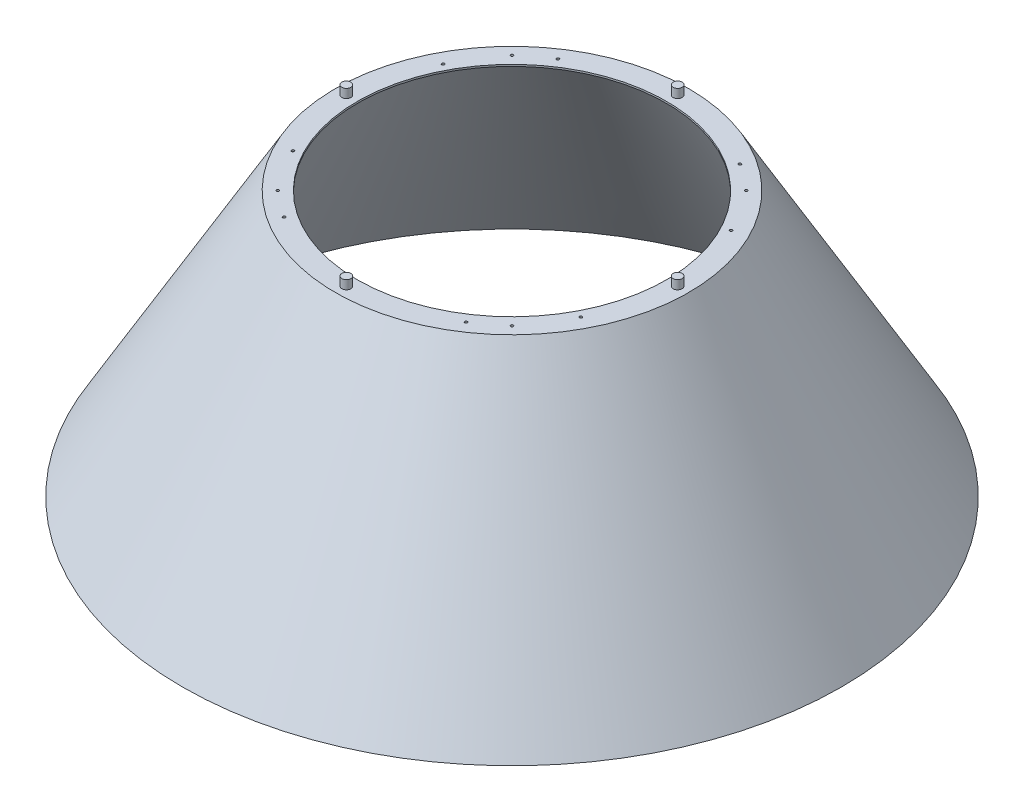
from build123d import *

# Parameters (mm, degrees)
SKETCH2_R           = 200
BOSS_EXTRUDE1_DEPTH = 300
BOSS_EXTRUDE1_DRAFT = -30
SHELL1_T            = -2
CUT_EXTRUDE1_REACH  = 1631.392
SKETCH3_R           = 1.5
SKETCH3_R_2         = 175
SKETCH4_R           = 5.1
BOSS_EXTRUDE2_DEPTH = 10
CUT_EXTRUDE4_REACH  = 1631.392
SKETCH5_R           = 1.5


with BuildPart() as part:
    # Sketch2 → Boss-Extrude1 (with draft: the straight prism first)
    with BuildSketch(Plane.XZ.offset(-263.664131829)):
        with Locations((394.086664394, 1032.562454189)):
            Circle(SKETCH2_R)
    extrude(amount=BOSS_EXTRUDE1_DEPTH)
    # Boss-Extrude1: the draft: its side faces are tilted about the plane it starts from
    boss_extrude1_sides = [part.faces().sort_by_distance(p)[0] for p in [
        (194.086664394, 113.664131829, 1032.562454189),
    ]]
    draft(boss_extrude1_sides, Plane.XZ.offset(-263.664131829), BOSS_EXTRUDE1_DRAFT)

    # Shell1
    shell1_openings = [part.faces().sort_by_distance(p)[0] for p in [
        (394.086664394, -36.335868171, 1032.562454189),
    ]]
    offset(amount=SHELL1_T, openings=shell1_openings, kind=Kind.INTERSECTION)

    # Sketch3 → Cut-Extrude1 (cut, up to next)
    with BuildSketch(Plane(origin=(0, 263.664131829, 0), x_dir=(1, 0, 0), z_dir=(0, 1, 0)), mode=Mode.PRIVATE) as cut_extrude1_sk1:
        with Locations(Location((261.504142922, -1165.144975661, 0), (0, 0, 270))):
            Circle(SKETCH3_R)
    cut_extrude1_tool1 = extrude(cut_extrude1_sk1.sketch, amount=-CUT_EXTRUDE1_REACH, mode=Mode.PRIVATE) & part.part
    # Sketch3 → Cut-Extrude1 (cut, up to next)
    with BuildSketch(Plane(origin=(0, 263.664131829, 0), x_dir=(1, 0, 0), z_dir=(0, 1, 0)), mode=Mode.PRIVATE) as cut_extrude1_sk2:
        with Locations(Location((526.669185867, -1165.144975661, 0), (0, 0, 270))):
            Circle(SKETCH3_R)
    cut_extrude1_tool2 = extrude(cut_extrude1_sk2.sketch, amount=-CUT_EXTRUDE1_REACH, mode=Mode.PRIVATE) & part.part
    # Sketch3 → Cut-Extrude1 (cut, up to next)
    with BuildSketch(Plane(origin=(0, 263.664131829, 0), x_dir=(1, 0, 0), z_dir=(0, 1, 0)), mode=Mode.PRIVATE) as cut_extrude1_sk3:
        with Locations(Location((526.669185867, -899.979932716, 0), (0, 0, 270))):
            Circle(SKETCH3_R)
    cut_extrude1_tool3 = extrude(cut_extrude1_sk3.sketch, amount=-CUT_EXTRUDE1_REACH, mode=Mode.PRIVATE) & part.part
    # Sketch3 → Cut-Extrude1 (cut, up to next)
    with BuildSketch(Plane(origin=(0, 263.664131829, 0), x_dir=(1, 0, 0), z_dir=(0, 1, 0)), mode=Mode.PRIVATE) as cut_extrude1_sk4:
        with Locations(Location((261.504142922, -899.979932716, 0), (0, 0, 270))):
            Circle(SKETCH3_R)
    cut_extrude1_tool4 = extrude(cut_extrude1_sk4.sketch, amount=-CUT_EXTRUDE1_REACH, mode=Mode.PRIVATE) & part.part
    # Sketch3 → Cut-Extrude1 (cut, up to next)
    with BuildSketch(Plane(origin=(0, 263.664131829, 0), x_dir=(1, 0, 0), z_dir=(0, 1, 0)), mode=Mode.PRIVATE) as cut_extrude1_sk5:
        with Locations(Location((394.086664394, -1032.562454189, 0), (0, 0, 270))):
            Circle(SKETCH3_R_2)
    cut_extrude1_tool5 = extrude(cut_extrude1_sk5.sketch, amount=-CUT_EXTRUDE1_REACH, mode=Mode.PRIVATE) & part.part
    add(cut_extrude1_tool1.solids().sort_by_distance((261.504143, 263.664132, 1165.144976))[0], mode=Mode.SUBTRACT)
    add(cut_extrude1_tool2.solids().sort_by_distance((526.669186, 263.664132, 1165.144976))[0], mode=Mode.SUBTRACT)
    add(cut_extrude1_tool3.solids().sort_by_distance((526.669186, 263.664132, 899.979933))[0], mode=Mode.SUBTRACT)
    add(cut_extrude1_tool4.solids().sort_by_distance((261.504143, 263.664132, 899.979933))[0], mode=Mode.SUBTRACT)
    add(cut_extrude1_tool5.solids().sort_by_distance((394.086664, 263.664132, 1032.562454))[0], mode=Mode.SUBTRACT)

    # Sketch4 → Boss-Extrude2 (add)
    with BuildSketch(Plane(origin=(0, 263.664131829, 0), x_dir=(1, 0, 0), z_dir=(0, 1, 0))):
        with Locations(Location((206.586664394, -1032.562454189, 0), (0, 0, 90))):
            Circle(SKETCH4_R)
        with Locations(Location((394.086664394, -845.062454189, 0), (0, 0, 90))):
            Circle(SKETCH4_R)
        with Locations(Location((581.586664394, -1032.562454189, 0), (0, 0, 90))):
            Circle(SKETCH4_R)
        with Locations(Location((394.086664394, -1220.062454189, 0), (0, 0, 90))):
            Circle(SKETCH4_R)
    extrude(amount=BOSS_EXTRUDE2_DEPTH)

    # Sketch5 → Cut-Extrude4 (cut, up to next)
    with BuildSketch(Plane(origin=(0, 263.664131829, 0), x_dir=(1, 0, 0), z_dir=(0, 1, 0)), mode=Mode.PRIVATE) as cut_extrude4_sk1:
        with Locations(Location((231.086664394, -1117.562454189, 0), (0, 0, 270))):
            Circle(SKETCH5_R)
    cut_extrude4_tool1 = extrude(cut_extrude4_sk1.sketch, amount=-CUT_EXTRUDE4_REACH, mode=Mode.PRIVATE) & part.part
    # Sketch5 → Cut-Extrude4 (cut, up to next)
    with BuildSketch(Plane(origin=(0, 263.664131829, 0), x_dir=(1, 0, 0), z_dir=(0, 1, 0)), mode=Mode.PRIVATE) as cut_extrude4_sk2:
        with Locations(Location((557.086664394, -1117.562454189, 0), (0, 0, 270))):
            Circle(SKETCH5_R)
    cut_extrude4_tool2 = extrude(cut_extrude4_sk2.sketch, amount=-CUT_EXTRUDE4_REACH, mode=Mode.PRIVATE) & part.part
    # Sketch5 → Cut-Extrude4 (cut, up to next)
    with BuildSketch(Plane(origin=(0, 263.664131829, 0), x_dir=(1, 0, 0), z_dir=(0, 1, 0)), mode=Mode.PRIVATE) as cut_extrude4_sk3:
        with Locations(Location((497.086664394, -1187.562454189, 0), (0, 0, 270))):
            Circle(SKETCH5_R)
    cut_extrude4_tool3 = extrude(cut_extrude4_sk3.sketch, amount=-CUT_EXTRUDE4_REACH, mode=Mode.PRIVATE) & part.part
    # Sketch5 → Cut-Extrude4 (cut, up to next)
    with BuildSketch(Plane(origin=(0, 263.664131829, 0), x_dir=(1, 0, 0), z_dir=(0, 1, 0)), mode=Mode.PRIVATE) as cut_extrude4_sk4:
        with Locations(Location((557.086664394, -947.562454189, 0), (0, 0, 270))):
            Circle(SKETCH5_R)
    cut_extrude4_tool4 = extrude(cut_extrude4_sk4.sketch, amount=-CUT_EXTRUDE4_REACH, mode=Mode.PRIVATE) & part.part
    # Sketch5 → Cut-Extrude4 (cut, up to next)
    with BuildSketch(Plane(origin=(0, 263.664131829, 0), x_dir=(1, 0, 0), z_dir=(0, 1, 0)), mode=Mode.PRIVATE) as cut_extrude4_sk5:
        with Locations(Location((497.086664394, -877.562454189, 0), (0, 0, 270))):
            Circle(SKETCH5_R)
    cut_extrude4_tool5 = extrude(cut_extrude4_sk5.sketch, amount=-CUT_EXTRUDE4_REACH, mode=Mode.PRIVATE) & part.part
    # Sketch5 → Cut-Extrude4 (cut, up to next)
    with BuildSketch(Plane(origin=(0, 263.664131829, 0), x_dir=(1, 0, 0), z_dir=(0, 1, 0)), mode=Mode.PRIVATE) as cut_extrude4_sk6:
        with Locations(Location((291.086664394, -877.562454189, 0), (0, 0, 270))):
            Circle(SKETCH5_R)
    cut_extrude4_tool6 = extrude(cut_extrude4_sk6.sketch, amount=-CUT_EXTRUDE4_REACH, mode=Mode.PRIVATE) & part.part
    # Sketch5 → Cut-Extrude4 (cut, up to next)
    with BuildSketch(Plane(origin=(0, 263.664131829, 0), x_dir=(1, 0, 0), z_dir=(0, 1, 0)), mode=Mode.PRIVATE) as cut_extrude4_sk7:
        with Locations(Location((231.086664394, -947.562454189, 0), (0, 0, 270))):
            Circle(SKETCH5_R)
    cut_extrude4_tool7 = extrude(cut_extrude4_sk7.sketch, amount=-CUT_EXTRUDE4_REACH, mode=Mode.PRIVATE) & part.part
    # Sketch5 → Cut-Extrude4 (cut, up to next)
    with BuildSketch(Plane(origin=(0, 263.664131829, 0), x_dir=(1, 0, 0), z_dir=(0, 1, 0)), mode=Mode.PRIVATE) as cut_extrude4_sk8:
        with Locations(Location((291.086664394, -1187.562454189, 0), (0, 0, 270))):
            Circle(SKETCH5_R)
    cut_extrude4_tool8 = extrude(cut_extrude4_sk8.sketch, amount=-CUT_EXTRUDE4_REACH, mode=Mode.PRIVATE) & part.part
    add(cut_extrude4_tool1.solids().sort_by_distance((231.086664, 263.664132, 1117.562454))[0], mode=Mode.SUBTRACT)
    add(cut_extrude4_tool2.solids().sort_by_distance((557.086664, 263.664132, 1117.562454))[0], mode=Mode.SUBTRACT)
    add(cut_extrude4_tool3.solids().sort_by_distance((497.086664, 263.664132, 1187.562454))[0], mode=Mode.SUBTRACT)
    add(cut_extrude4_tool4.solids().sort_by_distance((557.086664, 263.664132, 947.562454))[0], mode=Mode.SUBTRACT)
    add(cut_extrude4_tool5.solids().sort_by_distance((497.086664, 263.664132, 877.562454))[0], mode=Mode.SUBTRACT)
    add(cut_extrude4_tool6.solids().sort_by_distance((291.086664, 263.664132, 877.562454))[0], mode=Mode.SUBTRACT)
    add(cut_extrude4_tool7.solids().sort_by_distance((231.086664, 263.664132, 947.562454))[0], mode=Mode.SUBTRACT)
    add(cut_extrude4_tool8.solids().sort_by_distance((291.086664, 263.664132, 1187.562454))[0], mode=Mode.SUBTRACT)


solid = part.part
